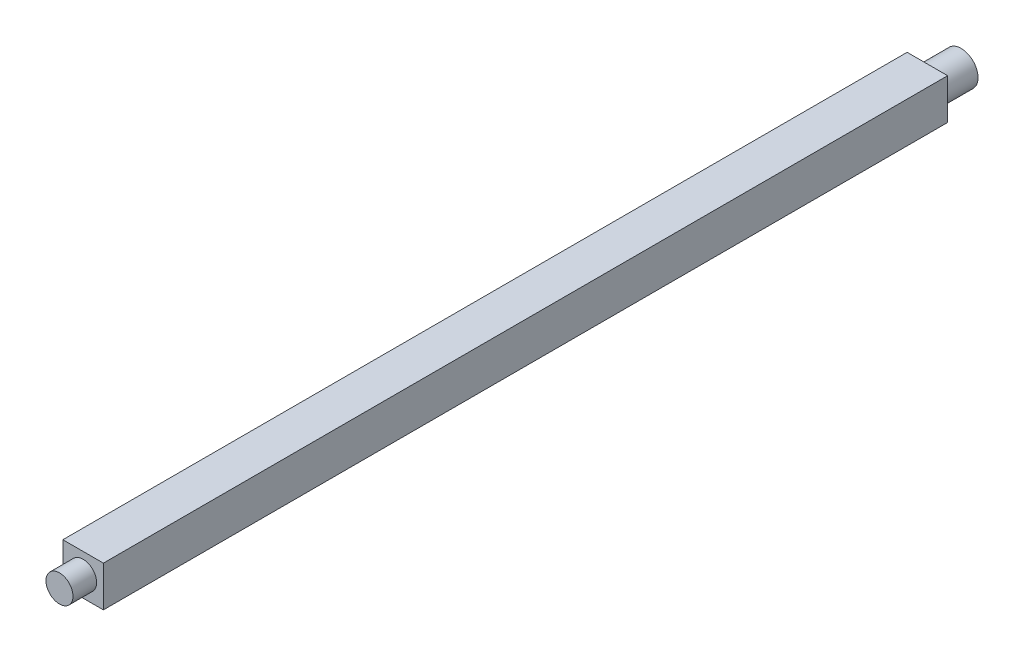
from build123d import *

# Parameters (mm, degrees)
EXTRUDE_1_DEPTH     = 250
SKETCH_2_R          = 2.5
EXTRUDE_2_DEPTH     = 10
SKETCH_3_R          = 5
EXTRUDE_3_DEPTH     = 10
SKETCH_4_W          = 2
SKETCH_4_H          = 1.835573614
CUT_EXTRUDE_1_DEPTH = 10
EXTRUDE_START       = -5
SKETCH_6_R          = 2.5
EXTRUDE_5_DEPTH     = 5
SKETCH_9_R          = 2.5
EXTRUDE_7_DEPTH     = 5
SKETCH_10_R         = 2.5
CUT_EXTRUDE_3_DEPTH = 3
CUT_EXTRUDE_START   = -3
SKETCH_11_R         = 2.5
CUT_EXTRUDE_4_DEPTH = 3
EXTRUDE_START_2     = -10
SKETCH_12_R         = 5
EXTRUDE_8_DEPTH     = 10
SKETCH_14_R         = 2.5
EXTRUDE_10_DEPTH    = 1
SKETCH_15_W         = 12
SKETCH_15_H         = 12
EXTRUDE_11_DEPTH    = 250
SKETCH_16_R         = 4
EXTRUDE_12_DEPTH    = 20


with BuildPart() as part:
    # 草图1 → 凸台-拉伸1 (new body)
    with BuildSketch(Plane.XY):
        Polygon((5, 0), (2.5, 4.330127019), (-2.5, 4.330127019), (-5, 0), (-2.5, -4.330127019), (2.5, -4.330127019), align=None)
    extrude(amount=EXTRUDE_1_DEPTH)

    # 草图2 → 凸台-拉伸2 (add)
    with BuildSketch(Plane.XY.offset(250)):
        Circle(SKETCH_2_R)
    extrude(amount=EXTRUDE_2_DEPTH)

    # 草图3 → 凸台-拉伸3 (add)
    with BuildSketch(Plane(origin=(0, 0, 0), x_dir=(-1, 0, 0), z_dir=(0, 0, -1))):
        Circle(SKETCH_3_R)
    extrude(amount=EXTRUDE_3_DEPTH)

    # 草图4 → 切除-拉伸1 (cut)
    with BuildSketch(Plane.XY.offset(260)):
        with Locations((0, 2.417786807)):
            Rectangle(SKETCH_4_W, SKETCH_4_H)
    extrude(amount=-CUT_EXTRUDE_1_DEPTH, mode=Mode.SUBTRACT)

    # 草图6 → 凸台-拉伸5 (add)
    with BuildSketch(Plane.XY.offset(260).offset(EXTRUDE_START)):
        with Locations(Location((0, 0, 0), (0, 0, 113.578178478))):
            Circle(SKETCH_6_R)
    extrude(amount=EXTRUDE_5_DEPTH)

    # 草图9 → 凸台-拉伸7 (add)
    with BuildSketch(Plane(origin=(0, 0, -10), x_dir=(-1, 0, 0), z_dir=(0, 0, -1))):
        with Locations(Location((0, 0, 0), (0, 0, 66.421821522))):
            Circle(SKETCH_9_R)
    extrude(amount=-EXTRUDE_7_DEPTH)

    # 草图10 → 切除-拉伸3 (cut)
    with BuildSketch(Plane(origin=(0, 0, -10), x_dir=(-1, 0, 0), z_dir=(0, 0, -1))):
        with Locations(Location((0, 0, 0), (0, 0, 66.421821522))):
            Circle(SKETCH_10_R)
    extrude(amount=-CUT_EXTRUDE_3_DEPTH, mode=Mode.SUBTRACT)

    # 草图11 → 切除-拉伸4 (cut)
    with BuildSketch(Plane.XY.offset(260).offset(CUT_EXTRUDE_START)):
        with Locations(Location((0, 0, 0), (0, 0, 113.578178478))):
            Circle(SKETCH_11_R)
    extrude(amount=CUT_EXTRUDE_4_DEPTH, mode=Mode.SUBTRACT)

    # 草图12 → 凸台-拉伸8 (add)
    with BuildSketch(Plane(origin=(0, 0, -10), x_dir=(-1, 0, 0), z_dir=(0, 0, -1)).offset(EXTRUDE_START_2)):
        Circle(SKETCH_12_R)
    extrude(amount=EXTRUDE_8_DEPTH)

    # 草图14 → 凸台-拉伸10 (add)
    with BuildSketch(Plane.XY.offset(250)):
        Circle(SKETCH_14_R)
    extrude(amount=EXTRUDE_10_DEPTH)

    # 草图15 → 凸台-拉伸11 (add)
    with BuildSketch(Plane.XY.offset(250)):
        Rectangle(SKETCH_15_W, SKETCH_15_H)
    extrude(amount=-EXTRUDE_11_DEPTH)

    # 草图16 → 凸台-拉伸12 (add)
    with BuildSketch(Plane.XY.offset(257)):
        Circle(SKETCH_16_R)
    extrude(amount=-EXTRUDE_12_DEPTH)


solid = part.part
